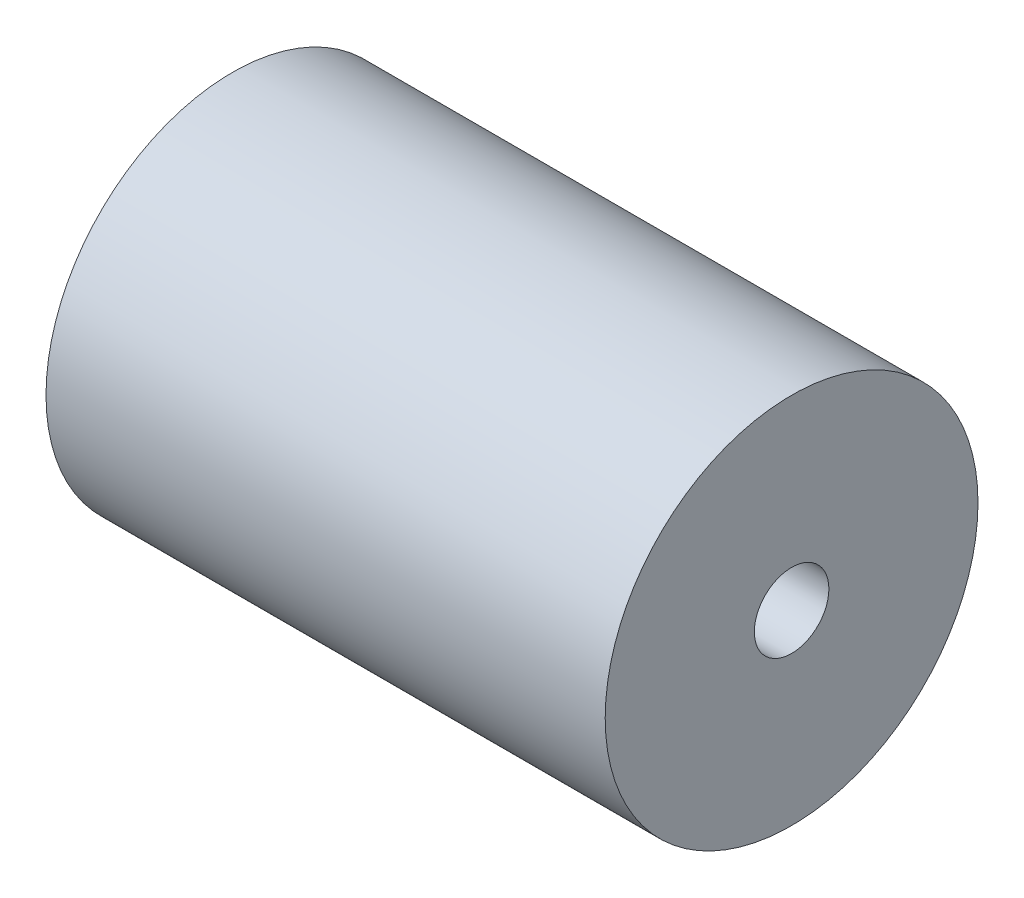
from build123d import *

# Parameters (mm, degrees)
SKETCH1_R           = 5
BOSS_EXTRUDE1_DEPTH = 15
SKETCH2_R           = 1
CUT_EXTRUDE1_DEPTH  = 10


with BuildPart() as part:
    # Sketch1 → Boss-Extrude1 (new body)
    with BuildSketch(Plane(origin=(0, 0, 0), x_dir=(0, 0, -1), z_dir=(1, 0, 0))):
        Circle(SKETCH1_R)
    extrude(amount=BOSS_EXTRUDE1_DEPTH)

    # Sketch2 → Cut-Extrude1 (cut)
    with BuildSketch(Plane(origin=(15, 0, 0), x_dir=(0, 0, -1), z_dir=(1, 0, 0))):
        Circle(SKETCH2_R)
    extrude(amount=-CUT_EXTRUDE1_DEPTH, mode=Mode.SUBTRACT)


solid = part.part
